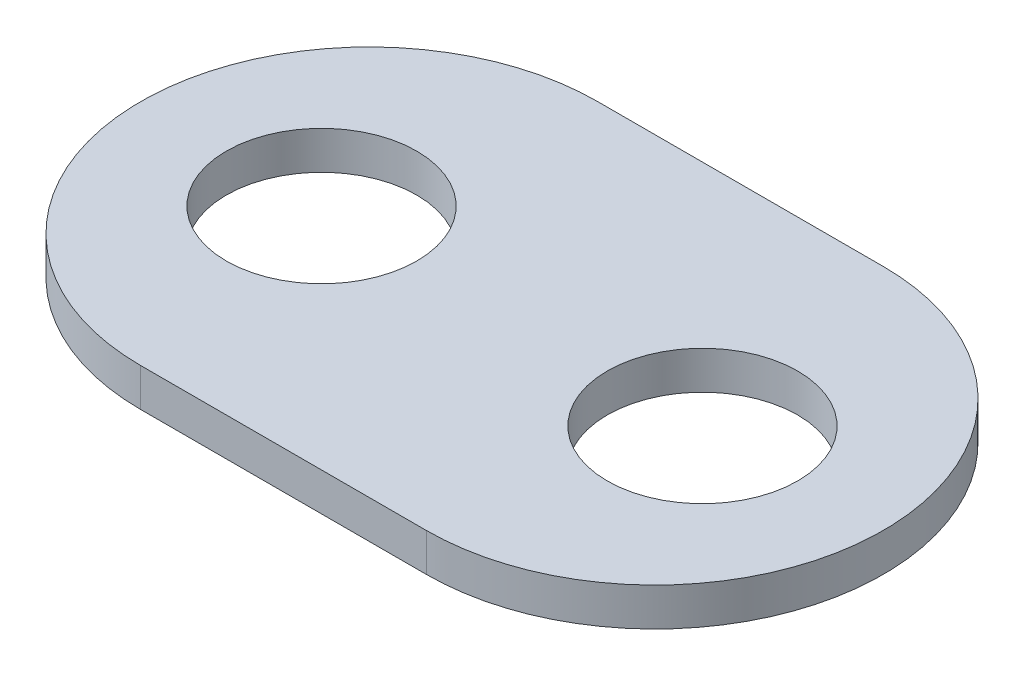
from build123d import *

# Parameters (mm, degrees)
SKETCH1_R           = 5
BOSS_EXTRUDE1_DEPTH = 2


with BuildPart() as part:
    # Sketch1 → Boss-Extrude1 (new body)
    with BuildSketch(Plane(origin=(0, 0, 0), x_dir=(1, 0, 0), z_dir=(0, 1, 0))):
        with BuildLine():
            Line((-7.5, -12), (7.5, -12))
            ThreePointArc((7.5, -12), (19.5, 0), (7.5, 12))
            Line((7.5, 12), (-7.5, 12))
            ThreePointArc((-7.5, 12), (-19.5, 0), (-7.5, -12))
        make_face()
        with Locations(Location((10, 0, 0), (0, 0, 270))):
            Circle(SKETCH1_R, mode=Mode.SUBTRACT)
        with Locations(Location((-10, 0, 0), (0, 0, 270))):
            Circle(SKETCH1_R, mode=Mode.SUBTRACT)
    extrude(amount=BOSS_EXTRUDE1_DEPTH)


solid = part.part
